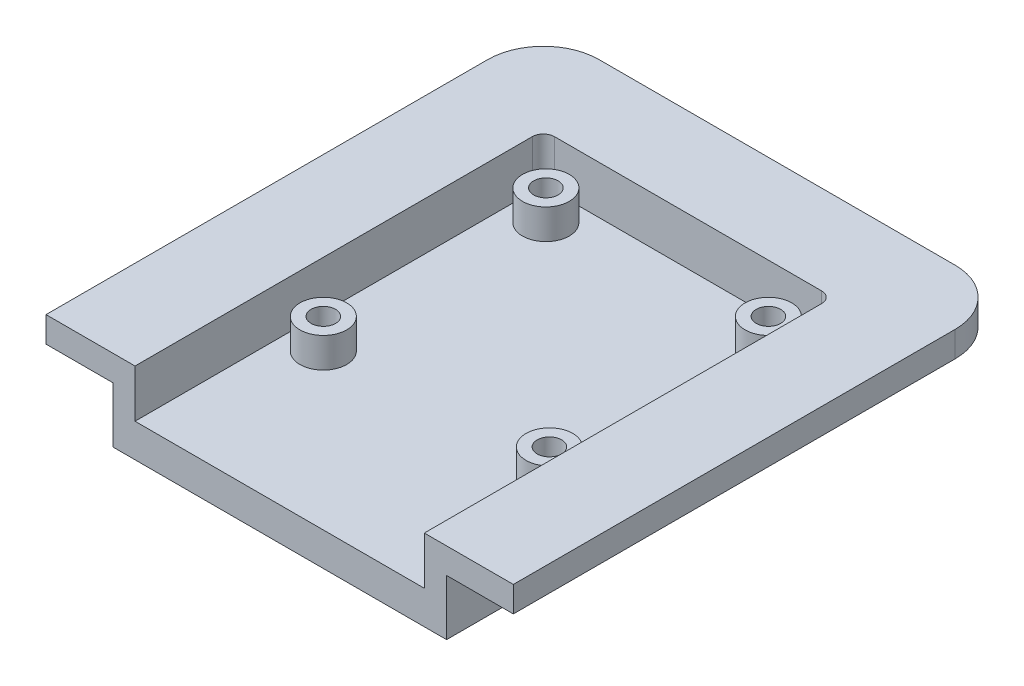
from build123d import *

# Parameters (mm, degrees)
SKETCH1_W           = 30
SKETCH1_H           = 38.7
BOSS_EXTRUDE1_DEPTH = 3
BOSS_EXTRUDE2_DEPTH = 4.3
FILLET1_R           = 1
SKETCH3_R           = 1.1
CUT_EXTRUDE1_DEPTH  = 25.857845844
BOSS_EXTRUDE3_START = 2.7
SKETCH4_R           = 2.1
SKETCH4_R_2         = 1.1
BOSS_EXTRUDE3_DEPTH = 2.7
BOSS_EXTRUDE4_START = 5
BOSS_EXTRUDE4_DEPTH = 2.3
FILLET2_R           = 5


with BuildPart() as part:
    # Sketch1 → Boss-Extrude1 (new body)
    with BuildSketch(Plane(origin=(0, 0, 0), x_dir=(1, 0, 0), z_dir=(0, 1, 0))):
        Rectangle(SKETCH1_W, SKETCH1_H)
    extrude(amount=BOSS_EXTRUDE1_DEPTH)

    # Sketch2 → Boss-Extrude2 (add)
    with BuildSketch(Plane(origin=(0, 3, 0), x_dir=(1, 0, 0), z_dir=(0, 1, 0))):
        Polygon((-13, 17.35), (-13, -19.35), (-15, -19.35), (-15, 19.35), (15, 19.35), (15, -19.35), (13, -19.35), (13, 17.35), align=None)
    extrude(amount=BOSS_EXTRUDE2_DEPTH)

    # Fillet1
    fillet1_edges = [part.edges().sort_by_distance(p)[0] for p in [
        (-13, 5.15, -17.35),
        (13, 5.15, -17.35),
    ]]
    fillet(fillet1_edges, radius=FILLET1_R)

    # Sketch3 → Cut-Extrude1 (cut, through all)
    with BuildSketch(Plane(origin=(0, 3, 0), x_dir=(1, 0, 0), z_dir=(0, 1, 0))):
        with Locations(Location((-10, 14.57312599, 0), (0, 0, 270))):
            Circle(SKETCH3_R)
        with Locations(Location((10, 14.57312599, 0), (0, 0, 270))):
            Circle(SKETCH3_R)
        with Locations(Location((-10, -5.42687401, 0), (0, 0, 270))):
            Circle(SKETCH3_R)
        with Locations(Location((10.317528275, -5.42687401, 0), (0, 0, 270))):
            Circle(SKETCH3_R)
    extrude(amount=-CUT_EXTRUDE1_DEPTH, mode=Mode.SUBTRACT)

    # Sketch4 → Boss-Extrude3 (add)
    # profile 1 of 4: a face of its own
    with BuildSketch(Plane(origin=(0, 3, 0), x_dir=(1, 0, 0), z_dir=(0, 1, 0)).offset(BOSS_EXTRUDE3_START)):
        with Locations(Location((-10, 14.57312599, 0), (0, 0, 270))):
            Circle(SKETCH4_R)
        with Locations(Location((-10, 14.57312599, 0), (0, 0, 270))):
            Circle(SKETCH4_R_2, mode=Mode.SUBTRACT)
    # profile 2 of 4: a face of its own
    with BuildSketch(Plane(origin=(0, 3, 0), x_dir=(1, 0, 0), z_dir=(0, 1, 0)).offset(BOSS_EXTRUDE3_START)):
        with Locations(Location((10, 14.57312599, 0), (0, 0, 270))):
            Circle(SKETCH4_R)
        with Locations(Location((10, 14.57312599, 0), (0, 0, 270))):
            Circle(SKETCH4_R_2, mode=Mode.SUBTRACT)
    # profile 3 of 4: a face of its own
    with BuildSketch(Plane(origin=(0, 3, 0), x_dir=(1, 0, 0), z_dir=(0, 1, 0)).offset(BOSS_EXTRUDE3_START)):
        with Locations(Location((10.317528275, -5.42687401, 0), (0, 0, 270))):
            Circle(SKETCH4_R)
        with Locations(Location((10.317528275, -5.42687401, 0), (0, 0, 270))):
            Circle(SKETCH4_R_2, mode=Mode.SUBTRACT)
    # profile 4 of 4: a face of its own
    with BuildSketch(Plane(origin=(0, 3, 0), x_dir=(1, 0, 0), z_dir=(0, 1, 0)).offset(BOSS_EXTRUDE3_START)):
        with Locations(Location((-10, -5.42687401, 0), (0, 0, 270))):
            Circle(SKETCH4_R)
        with Locations(Location((-10, -5.42687401, 0), (0, 0, 270))):
            Circle(SKETCH4_R_2, mode=Mode.SUBTRACT)
    extrude(amount=-BOSS_EXTRUDE3_DEPTH)

    # Sketch5 → Boss-Extrude4 (add)
    with BuildSketch(Plane(origin=(0, 0, 0), x_dir=(1, 0, 0), z_dir=(0, 1, 0)).offset(BOSS_EXTRUDE4_START)):
        Polygon((-21, 25.35), (21, 25.35), (21, -19.35), (15, -19.35), (15, 19.35), (-15, 19.35), (-15, -19.35), (-21, -19.35), align=None)
    extrude(amount=BOSS_EXTRUDE4_DEPTH)

    # Fillet2
    fillet2_edges = [part.edges().sort_by_distance(p)[0] for p in [
        (-21, 6.15, -25.35),
        (21, 6.15, -25.35),
    ]]
    fillet(fillet2_edges, radius=FILLET2_R)


solid = part.part
